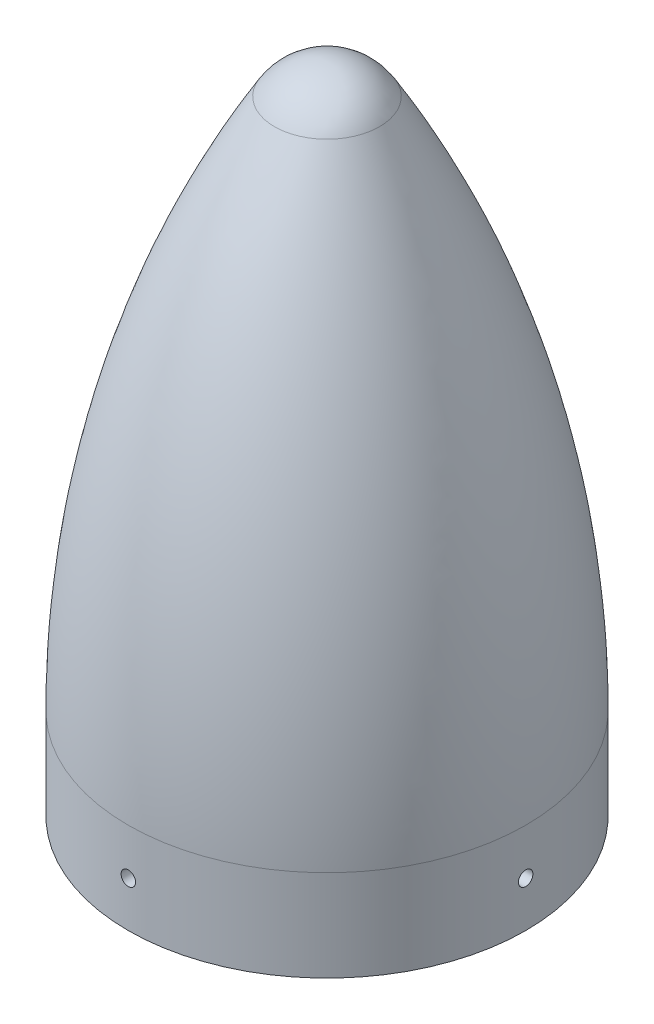
from build123d import *

# Parameters (mm, degrees)
SKETCH7_R          = 1.5
CUT_EXTRUDE1_DEPTH = 3.81
CIRPATTERN1_COUNT  = 4


with BuildPart() as part:
    # Sketch1 → Revolve1 (revolve)
    with BuildSketch(Plane.XY, mode=Mode.PRIVATE) as revolve1_sk:
        with BuildLine():
            Line((0, 116.639076478), (0, 110.289076478))
            add(Edge.make_bspline(
                [(-34.925, 0), (-35.711738611, 37.014385541), (-24.511570594, 69.455143498), (-5.844600922, 109.524219753), (0, 110.289076478)],
                knots=[0, 0, 0, 0, 0.860279712, 1, 1, 1, 1], degree=3))
            Line((-34.925, 0), (-38.1, 0))
            Line((-38.1, 0), (-38.1, -18.95))
            Line((-38.1, -18.95), (-41.275, -18.95))
            Line((-41.275, -18.95), (-41.275, 0))
            add(Edge.make_bspline(
                [(-41.275, 0), (-41.275, 0.330502854), (-41.273557103, 0.805649639), (-41.268747446, 1.912092247), (-41.257925909, 2.719246857), (-41.246383117, 3.563883335), (-41.228347866, 4.535820012), (-41.200734551, 5.734179725), (-41.159757311, 7.129726347), (-41.100846347, 8.735373987), (-41.029571588, 10.346697141), (-40.946255064, 11.958844584), (-40.850901423, 13.569512918), (-40.743515987, 15.179892998), (-40.624104745, 16.789166096), (-40.459816828, 18.799743968), (-40.238647793, 21.210299788), (-39.945617875, 24.019277994), (-39.562802148, 27.224148418), (-38.809156369, 32.822061303), (-36.96766496, 43.970323281), (-33.49128341, 58.923697069), (-28.30812049, 74.663796505), (-22.487129194, 88.42095936), (-18.428836954, 96.767582764), (-16.193226279, 101.062272388), (-14.657371604, 103.891195217), (-13.781700582, 105.466687496), (-13.19565908, 106.505983946), (-12.707159013, 107.362552916), (-12.311115433, 108.050979413), (-11.92041177, 108.724783551), (-11.526473808, 109.398380474), (-11.168679866, 110.0041541), (-10.999621727, 110.28932335), (-10.915144579, 110.431350258)],
                knots=[0.08301761, 0.08301761, 0.08301761, 0.08301761, 0.08301761, 0.094422695, 0.100125237, 0.105827779, 0.111530322, 0.117232864, 0.128637949, 0.140293389, 0.15194883, 0.163604271, 0.175259711, 0.186915153, 0.198570596, 0.210226038, 0.22188148, 0.245192344, 0.268503208, 0.291814091, 0.315124974, 0.408368487, 0.594855494, 0.734720752, 0.792997941, 0.839619695, 0.862930572, 0.87458601, 0.885991093, 0.891693634, 0.897396175, 0.903098717, 0.908801258, 0.914503799, 0.920206341, 0.920206341, 0.920206341, 0.920206341, 0.920206341], degree=4))
            ThreePointArc((-10.915144579, 110.431350258), (-6.278460122, 114.97859361), (0, 116.639076478))
        make_face()
    revolve(revolve1_sk.sketch.rotate(Axis((0, 0, 0), (0, 1, 0)), 270), axis=Axis((0, 0, 0), (0, 1, 0)))

    # Sketch7 → Cut-Extrude1 (cut)
    with BuildSketch(Plane.XY.offset(41.275)):
        with Locations((0, -9.525)):
            Circle(SKETCH7_R)
    cut_extrude1 = extrude(amount=-CUT_EXTRUDE1_DEPTH, mode=Mode.SUBTRACT)

    # CirPattern1: Cut-Extrude1 ×4 about axis
    cirpattern1_axis = Axis((0, 0, 0), (0, -1, 0))
    for i in range(1, CIRPATTERN1_COUNT):
        add(cut_extrude1.rotate(cirpattern1_axis, i * 360 / CIRPATTERN1_COUNT), mode=Mode.SUBTRACT)


solid = part.part
